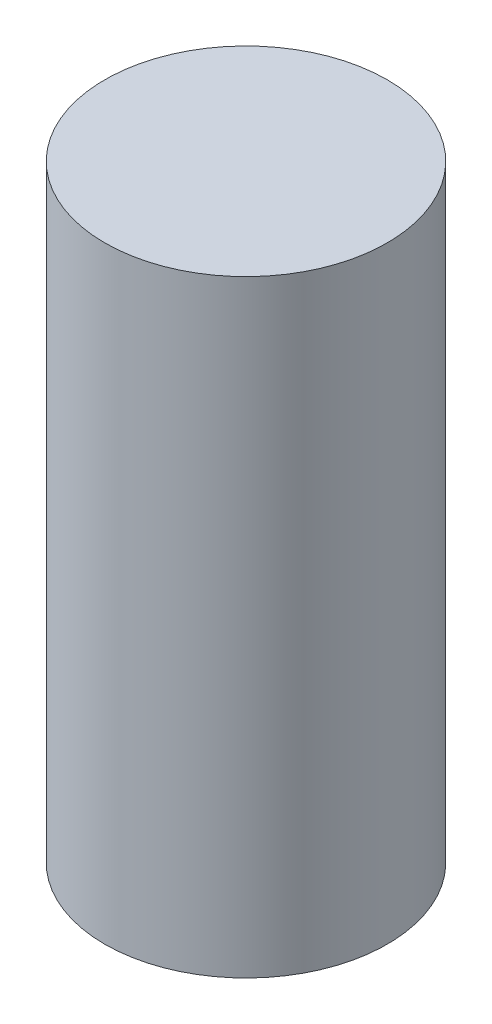
from build123d import *

# Parameters (mm, degrees)
SKETCH1_R           = 50
BOSS_EXTRUDE1_DEPTH = 215
SCALE1_SCALE        = 0.75


with BuildPart() as part:
    # Sketch1 → Boss-Extrude1 (new body)
    with BuildSketch(Plane(origin=(0, 0, 0), x_dir=(1, 0, 0), z_dir=(0, 1, 0))):
        with Locations(Location((0, 0, 0), (0, 0, 270))):
            Circle(SKETCH1_R)
    extrude(amount=BOSS_EXTRUDE1_DEPTH)


with BuildPart() as part_1:
    # Scale1: scaled about (0, 107.5, 0)
    add(part.part.scale(SCALE1_SCALE).moved(Location((0, 26.875, 0))))


solid = part_1.part
